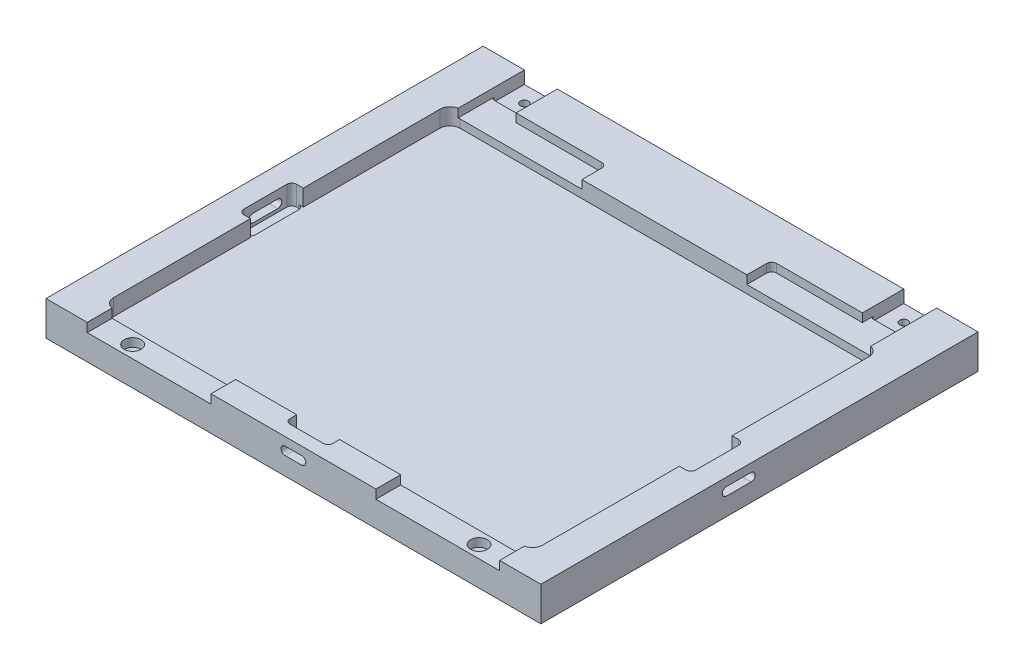
from build123d import *

# Parameters (mm, degrees)
SKETCH_1_W                 = 260
SKETCH_1_H                 = 265
EXTRUDE_577_DEPTH          = 5.8
SKETCH_17_W                = 260
SKETCH_17_H                = 15
EXTRUDE_803_DEPTH          = 10
SKETCH_19_W                = 265
SKETCH_19_H                = 15.8
EXTRUDE_982_DEPTH          = 20
SKETCH_20_W                = 265
SKETCH_20_H                = 15.8
EXTRUDE_1186_DEPTH         = 20
SKETCH_22_W                = 75
SKETCH_22_H                = 15
CUT_EXTRUDE_1675_DEPTH     = 5.4
SKETCH_25_W                = 5
SKETCH_25_H                = 40.1
EXTRUDE_1_DEPTH            = 10
SKETCH_26_W                = 250
SKETCH_26_H                = 25.1
EXTRUDE_1_2_DEPTH          = 4.9
HOLE_WIZARD_M6_D           = 5
HOLE_WIZARD_M6_CSINK_D     = 6.05
HOLE_WIZARD_M6_CSINK_ANGLE = 90
SKETCH_27_W                = 210
SKETCH_27_H                = 25.1
EXTRUDE_3711_DEPTH         = 5.1
CUT_EXTRUDE_1_DEPTH        = 329.338072724
CUT_EXTRUDE_2_REACH        = 306.917
SKETCH_29_R                = 5.1
CUT_EXTRUDE_4572_DEPTH     = 5.1
HOLE_WIZARD_3_D            = 2.5
HOLE_WIZARD_3_CSINK_D      = 3.05
HOLE_WIZARD_3_CSINK_ANGLE  = 90
SKETCH_32_W                = 250
SKETCH_32_H                = 15
EXTRUDE_3_DEPTH            = 4.9
SKETCH_38_W                = 100
SKETCH_38_H                = 15
EXTRUDE_2_DEPTH            = 5.1
SKETCH_34_W                = 300
SKETCH_34_H                = 265
EXTRUDE_4_DEPTH            = 5
SKETCH_33_R                = 20
EXTRUDE_7147_DEPTH         = 5.2
SKETCH_36_W                = 7
SKETCH_36_H                = 32
SKETCH_36_W_2              = 26
SKETCH_36_H_2              = 7
CUT_EXTRUDE_7671_DEPTH     = 12
FILLET_2_R                 = 3
FILLET_3_R                 = 6
SKETCH_39_W                = 20
SKETCH_39_H                = 20
CUT_EXTRUDE_1_2_DEPTH      = 2.5
FILLET_4_R                 = 1.5


with BuildPart() as part:
    # Эскиз1 → Extrude 577 (new body)
    with BuildSketch(Plane(origin=(0, 0, 0), x_dir=(1, 0, 0), z_dir=(0, 1, 0))):
        Rectangle(SKETCH_1_W, SKETCH_1_H)
    extrude(amount=EXTRUDE_577_DEPTH)

    # Эскиз17 → Extrude 803 (add)
    with BuildSketch(Plane(origin=(0, 5.8, 0), x_dir=(1, 0, 0), z_dir=(0, 1, 0))):
        with Locations((0, -125)):
            Rectangle(SKETCH_17_W, SKETCH_17_H)
    extrude(amount=EXTRUDE_803_DEPTH)

    # Эскиз19 → Extrude 982 (add)
    with BuildSketch(Plane(origin=(130, 0, 0), x_dir=(0, 0, -1), z_dir=(1, 0, 0))):
        with Locations((0, 7.9)):
            Rectangle(SKETCH_19_W, SKETCH_19_H)
    extrude(amount=EXTRUDE_982_DEPTH)

    # Эскиз20 → Extrude 1186 (add)
    with BuildSketch(Plane.ZY.offset(130)):
        with Locations((0, 7.9)):
            Rectangle(SKETCH_20_W, SKETCH_20_H)
    extrude(amount=EXTRUDE_1186_DEPTH)

    # Эскиз22 → Cut-Extrude 1675 (cut)
    with BuildSketch(Plane(origin=(0, 15.8, 0), x_dir=(1, 0, 0), z_dir=(0, 1, 0))):
        with Locations((-87.5, -125)):
            Rectangle(SKETCH_22_W, SKETCH_22_H)
        with Locations((87.5, -125)):
            Rectangle(SKETCH_22_W, SKETCH_22_H)
    extrude(amount=-CUT_EXTRUDE_1675_DEPTH, mode=Mode.SUBTRACT)

    # Эскиз25 → Extrude 1 (add)
    with BuildSketch(Plane(origin=(0, 5.8, 0), x_dir=(1, 0, 0), z_dir=(0, 1, 0))):
        with Locations((127.5, 112.45)):
            Rectangle(SKETCH_25_W, SKETCH_25_H)
        with Locations((-127.5, 112.45)):
            Rectangle(SKETCH_25_W, SKETCH_25_H)
    extrude(amount=EXTRUDE_1_DEPTH)

    # Эскиз26 → Extrude 1 2 (add)
    with BuildSketch(Plane(origin=(0, 5.8, 0), x_dir=(1, 0, 0), z_dir=(0, 1, 0))):
        with Locations((0, 119.95)):
            Rectangle(SKETCH_26_W, SKETCH_26_H)
    extrude(amount=EXTRUDE_1_2_DEPTH)

    # Крепление для уровня M6 (through all)
    with Locations(Plane(origin=(0, 10.7, 0), x_dir=(1, 0, 0), z_dir=(0, 1, 0))):
        with Locations((-115, 122.5), (115, 122.5)):
            CounterSinkHole(HOLE_WIZARD_M6_D / 2, HOLE_WIZARD_M6_CSINK_D / 2, counter_sink_angle=HOLE_WIZARD_M6_CSINK_ANGLE)

    # Эскиз27 → Extrude 3711 (add)
    with BuildSketch(Plane(origin=(0, 10.7, 0), x_dir=(1, 0, 0), z_dir=(0, 1, 0))):
        with Locations((0, 119.95)):
            Rectangle(SKETCH_27_W, SKETCH_27_H)
    extrude(amount=EXTRUDE_3711_DEPTH)

    # Эскиз28 → Cut-Extrude 1 (cut, through all)
    with BuildSketch(Plane(origin=(150, 0, 0), x_dir=(0, 0, -1), z_dir=(1, 0, 0))):
        with BuildLine():
            Line((-20.05, 10.8), (-5.05, 10.8))
            ThreePointArc((-5.05, 10.8), (-2.55, 8.3), (-5.05, 5.8))
            Line((-5.05, 5.8), (-20.05, 5.8))
            ThreePointArc((-20.05, 5.8), (-22.55, 8.3), (-20.05, 10.8))
        make_face()
    extrude(amount=-CUT_EXTRUDE_1_DEPTH, mode=Mode.SUBTRACT)

    # Эскиз37 → Регулировка-2 (cut, up to next)
    with BuildSketch(Plane.XY.offset(132.5), mode=Mode.PRIVATE) as cut_extrude_2_sk1:
        with BuildLine():
            Line((-5, 10.8), (5, 10.8))
            ThreePointArc((5, 10.8), (7.5, 8.3), (5, 5.8))
            Line((5, 5.8), (-5, 5.8))
            ThreePointArc((-5, 5.8), (-7.5, 8.3), (-5, 10.8))
        make_face()
    cut_extrude_2_tool1 = extrude(cut_extrude_2_sk1.sketch, amount=-CUT_EXTRUDE_2_REACH, mode=Mode.PRIVATE) & part.part
    add(cut_extrude_2_tool1.solids().sort_by_distance((0, 8.3, 132.5))[0], mode=Mode.SUBTRACT)

    # Эскиз29 → Cut-Extrude 4572 (cut)
    with BuildSketch(Plane(origin=(0, 10.4, 0), x_dir=(1, 0, 0), z_dir=(0, 1, 0))):
        with Locations(Location((-105, -125, 0), (0, 0, 270))):
            Circle(SKETCH_29_R)
        with Locations(Location((105, -125, 0), (0, 0, 270))):
            Circle(SKETCH_29_R)
    extrude(amount=-CUT_EXTRUDE_4572_DEPTH, mode=Mode.SUBTRACT)

    # КреплениеМагнитов-М3 (through all)
    with Locations(Plane(origin=(0, 5.3, 0), x_dir=(1, 0, 0), z_dir=(0, 1, 0))):
        with Locations((-105, -125), (105, -125)):
            CounterSinkHole(HOLE_WIZARD_3_D / 2, HOLE_WIZARD_3_CSINK_D / 2, counter_sink_angle=HOLE_WIZARD_3_CSINK_ANGLE)

    # Эскиз32 → Бобышка-Вытянуть3 (add)
    with BuildSketch(Plane(origin=(0, 5.8, 0), x_dir=(1, 0, 0), z_dir=(0, 1, 0))):
        with Locations((0, 99.9)):
            Rectangle(SKETCH_32_W, SKETCH_32_H)
    extrude(amount=EXTRUDE_3_DEPTH)

    # Эскиз38 → НаправляющийВынос-2 (add)
    with BuildSketch(Plane(origin=(0, 10.7, 0), x_dir=(1, 0, 0), z_dir=(0, 1, 0))):
        with Locations((0, 99.9)):
            Rectangle(SKETCH_38_W, SKETCH_38_H)
    extrude(amount=EXTRUDE_2_DEPTH)

    # Эскиз34 → Бобышка-Вытянуть4 (add)
    with BuildSketch(Plane.XZ):
        Rectangle(SKETCH_34_W, SKETCH_34_H)
    extrude(amount=EXTRUDE_4_DEPTH)

    # Эскиз33 → Extrude 7147 (add)
    with BuildSketch(Plane.XZ.offset(5)):
        with Locations(Location((0, 0, 0), (0, 0, 270))):
            Circle(SKETCH_33_R)
        with Locations(Location((-120, 102.5, 0), (0, 0, 270))):
            Circle(SKETCH_33_R)
        with Locations(Location((120, 102.5, 0), (0, 0, 270))):
            Circle(SKETCH_33_R)
        with Locations(Location((120, -92.5, 0), (0, 0, 270))):
            Circle(SKETCH_33_R)
        with Locations(Location((-120, -92.5, 0), (0, 0, 270))):
            Circle(SKETCH_33_R)
    extrude(amount=EXTRUDE_7147_DEPTH)

    # Эскиз36 → Cut-Extrude 7671 (cut)
    with BuildSketch(Plane(origin=(0, 15.8, 0), x_dir=(1, 0, 0), z_dir=(0, 1, 0))):
        with Locations((133.5, -12.55)):
            Rectangle(SKETCH_36_W, SKETCH_36_H)
        with Locations((-133.5, -12.55)):
            Rectangle(SKETCH_36_W, SKETCH_36_H)
        with Locations((0, -121)):
            Rectangle(SKETCH_36_W_2, SKETCH_36_H_2)
    extrude(amount=-CUT_EXTRUDE_7671_DEPTH, mode=Mode.SUBTRACT)

    # Скругление2
    fillet_2_edges = [part.edges().sort_by_distance(p)[0] for p in [
        (50, 13.25, -107.4),
        (-50, 13.25, -107.4),
        (137, 9.8, -3.45),
        (137, 9.8, 28.55),
        (130, 4.8, 28.55),
        (130, 4.8, -3.45),
        (-130, 4.8, -3.45),
        (-130, 4.8, 28.55),
        (-137, 9.8, 28.55),
        (-137, 9.8, -3.45),
        (-13, 9.8, 124.5),
        (-13, 4.8, 117.5),
        (13, 4.8, 117.5),
        (13, 9.8, 124.5),
    ]]
    fillet(fillet_2_edges, radius=FILLET_2_R)

    # Скругление3
    fillet_3_edges = [part.edges().sort_by_distance(p)[0] for p in [
        (130, 10.8, 117.5),
        (130, 10.8, -92.4),
        (-130, 10.8, 117.5),
        (-130, 10.8, -92.4),
    ]]
    fillet(fillet_3_edges, radius=FILLET_3_R)

    # Эскиз39 → Cut-Extrude 1 2 (cut)
    with BuildSketch(Plane(origin=(0, 10.7, 0), x_dir=(1, 0, 0), z_dir=(0, 1, 0))):
        with Locations((-115, 122.5)):
            Rectangle(SKETCH_39_W, SKETCH_39_H)
        with Locations((115, 122.5)):
            Rectangle(SKETCH_39_W, SKETCH_39_H)
    extrude(amount=-CUT_EXTRUDE_1_2_DEPTH, mode=Mode.SUBTRACT)

    # Скругление4
    fillet_4_edges = [part.edges().sort_by_distance(p)[0] for p in [
        (-105, 9.45, -112.5),
        (-125, 9.45, -112.5),
        (105, 9.45, -112.5),
        (125, 9.45, -112.5),
    ]]
    fillet(fillet_4_edges, radius=FILLET_4_R)


solid = part.part
